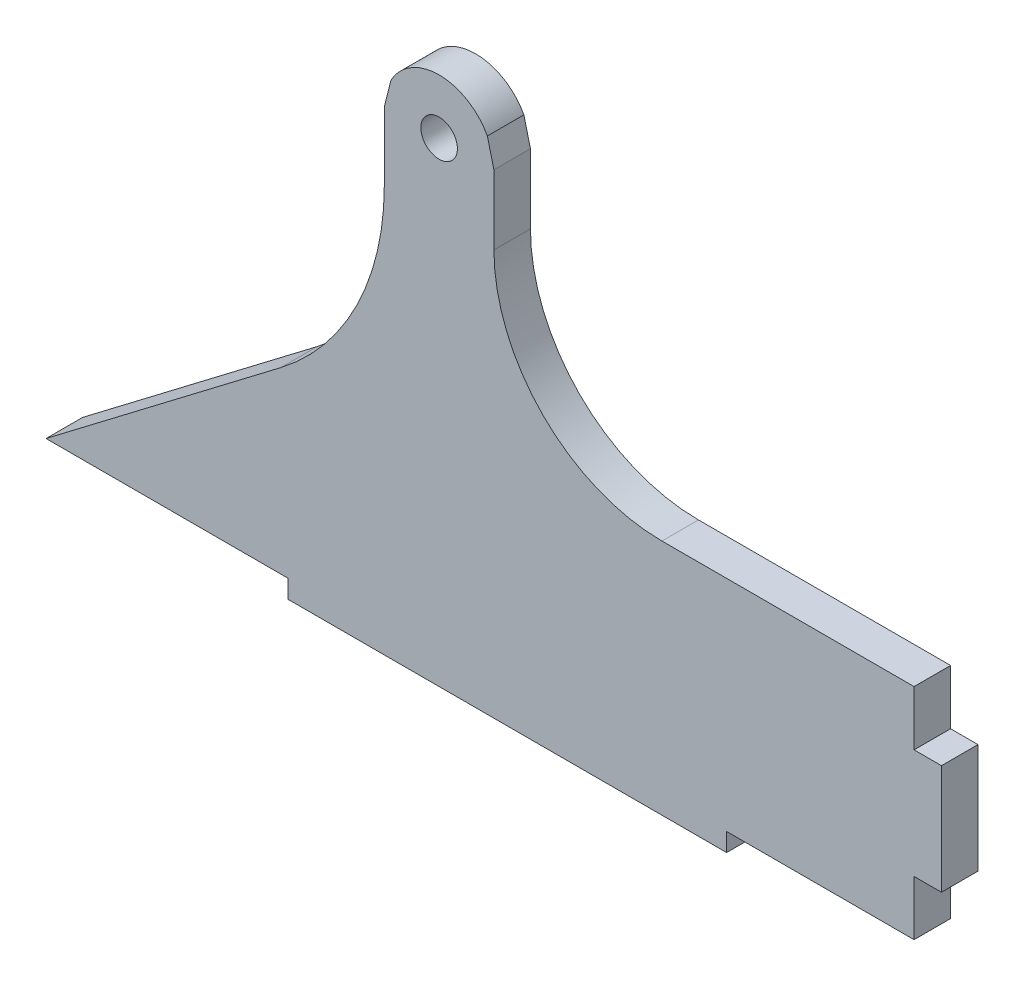
from build123d import *

# Parameters (mm, degrees)
SKETCH1_R           = 6.35
BOSS_EXTRUDE1_DEPTH = 12.7


with BuildPart() as part:
    # Sketch1 → Boss-Extrude1 (new body)
    with BuildSketch(Plane.XY):
        with BuildLine():
            Line((129.803523023, 13.72866743), (129.803523023, 32.77866743))
            Line((129.803523023, 32.77866743), (104.403523023, 32.77866743))
            Line((104.403523023, 32.77866743), (89.290523023, 32.77866743))
            Line((89.290523023, 32.77866743), (51.190523023, 32.77866743))
            Line((51.190523023, 32.77866743), (44.078523023, 32.77866743))
            Line((44.078523023, 32.77866743), (42.173523023, 32.77866743))
            ThreePointArc((42.173523023, 32.77866743), (0.864344867, 49.889489273), (-16.246476977, 91.19866743))
            Line((-16.246476977, 91.19866743), (-16.246476977, 115.32866743))
            Line((-16.246476977, 115.32866743), (-18.528129693, 124.368857105))
            ThreePointArc((-18.528129693, 124.368857105), (-35.296476977, 134.37866743), (-52.064824261, 124.368857105))
            Line((-52.064824261, 124.368857105), (-54.346476977, 115.32866743))
            Line((-54.346476977, 115.32866743), (-54.346476977, 91.438289009))
            ThreePointArc((-54.346476977, 91.438289009), (-63.850433524, 50.845698757), (-90.386686587, 18.691214671))
            Line((-90.386686587, 18.691214671), (-171.948476977, -43.42133257))
            Line((-171.948476977, -43.42133257), (-87.747476977, -43.42133257))
            Line((-87.747476977, -43.42133257), (-87.747476977, -49.77133257))
            Line((-87.747476977, -49.77133257), (-61.229320991, -49.77133257))
            Line((-61.229320991, -49.77133257), (-16.694588765, -49.77133257))
            Line((-16.694588765, -49.77133257), (64.652523023, -49.77133257))
            Line((64.652523023, -49.77133257), (64.652523023, -43.42133257))
            Line((64.652523023, -43.42133257), (129.803523023, -43.42133257))
            Line((129.803523023, -43.42133257), (129.803523023, -24.37133257))
            Line((129.803523023, -24.37133257), (139.328523023, -24.37133257))
            Line((139.328523023, -24.37133257), (139.328523023, 13.72866743))
            Line((139.328523023, 13.72866743), (129.803523023, 13.72866743))
        make_face()
        with Locations((-35.296476977, 115.32866743)):
            Circle(SKETCH1_R, mode=Mode.SUBTRACT)
    extrude(amount=BOSS_EXTRUDE1_DEPTH)


solid = part.part
